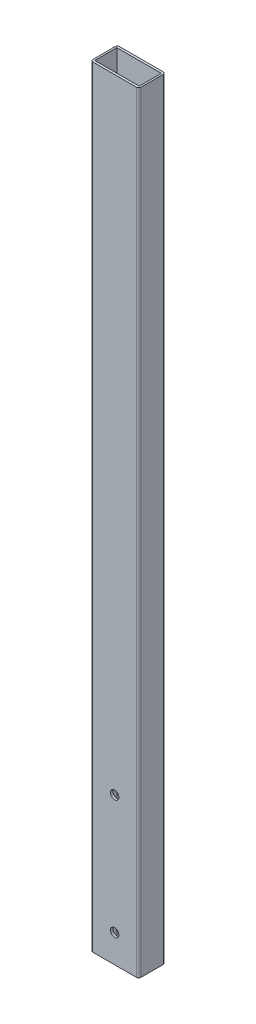
from build123d import *

# Parameters (mm, degrees)
SKETCH1_W               = 34.29
SKETCH1_H               = 19.05
SKETCH1_W_2             = 31.75
SKETCH1_H_2             = 15.748
BOSS_EXTRUDE1_DEPTH     = 550
FILLET1_R               = 1.5
CUT_EXTRUDE1_DEPTH      = 551.59681576
CUT_EXTRUDE1_DEPTH_BACK = 551.59681576
SKETCH2_R               = 3


with BuildPart() as part:
    # Sketch1 → Boss-Extrude1 (new body)
    with BuildSketch(Plane(origin=(0, 0, 0), x_dir=(1, 0, 0), z_dir=(0, 1, 0))):
        Rectangle(SKETCH1_W, SKETCH1_H)
        Rectangle(SKETCH1_W_2, SKETCH1_H_2, mode=Mode.SUBTRACT)
    extrude(amount=BOSS_EXTRUDE1_DEPTH)

    # Fillet1
    fillet1_edges = [part.edges().sort_by_distance(p)[0] for p in [
        (17.145, 275, 9.525),
        (-17.145, 275, 9.525),
        (-17.145, 275, -9.525),
        (17.145, 275, -9.525),
    ]]
    fillet(fillet1_edges, radius=FILLET1_R)

    # Sketch2 → Cut-Extrude1 (cut, two sides: drawn at the far end of the back side and taken through both)
    with BuildSketch(Plane.XY.offset(9.525).offset(-CUT_EXTRUDE1_DEPTH_BACK)):
        with Locations(Location((0, 105, 0), (0, 0, 180))):
            Circle(SKETCH2_R)
        with Locations(Location((0, 20, 0), (0, 0, 180))):
            Circle(SKETCH2_R)
    extrude(amount=CUT_EXTRUDE1_DEPTH + CUT_EXTRUDE1_DEPTH_BACK, mode=Mode.SUBTRACT)


solid = part.part
